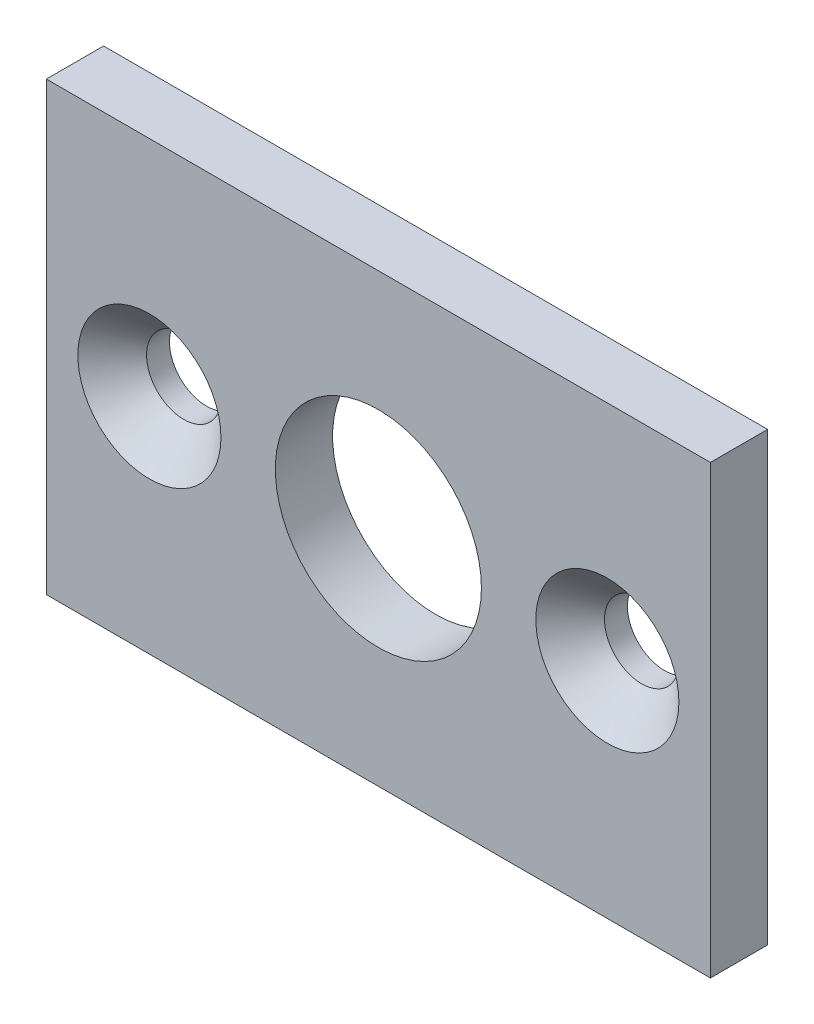
from build123d import *

# Parameters (mm, degrees)
ESQUISSE1_W                = 58
ESQUISSE1_H                = 39
ESQUISSE1_R                = 9
BOSS_EXTRU_1_DEPTH         = 5
R_P_TITION_LIN_AIRE1_COUNT = 2
R_P_TITION_LIN_AIRE1_PITCH = 40


with BuildPart() as part:
    # Esquisse1 → Boss.-Extru.1 (new body)
    with BuildSketch(Plane.XY):
        Rectangle(ESQUISSE1_W, ESQUISSE1_H)
        Circle(ESQUISSE1_R, mode=Mode.SUBTRACT)
    extrude(amount=BOSS_EXTRU_1_DEPTH)

    # Esquisse3 → Fraisage pour vis à tête fraisée à 6 pans creux M61 (revolve, cut)
    with BuildSketch(Plane(origin=(20, 0, 5), x_dir=(0, -1, 0), z_dir=(1, 0, 0))):
        Polygon((0, 0), (0, 5), (3.25, 5), (3.25, 3), (6.25, 0), align=None)
    fraisage_pour_vis_t_te_frais_e_6_pan = revolve(axis=Axis((20, 0, 11.35), (0, 0, -1)), mode=Mode.SUBTRACT)

    # Répétition linéaire1: Fraisage pour vis à tête fraisée à 6 pans creux M61 ×2
    with Locations(*[(-i * R_P_TITION_LIN_AIRE1_PITCH, 0, 0) for i in range(1, R_P_TITION_LIN_AIRE1_COUNT)]):
        add(fraisage_pour_vis_t_te_frais_e_6_pan, mode=Mode.SUBTRACT)


solid = part.part
